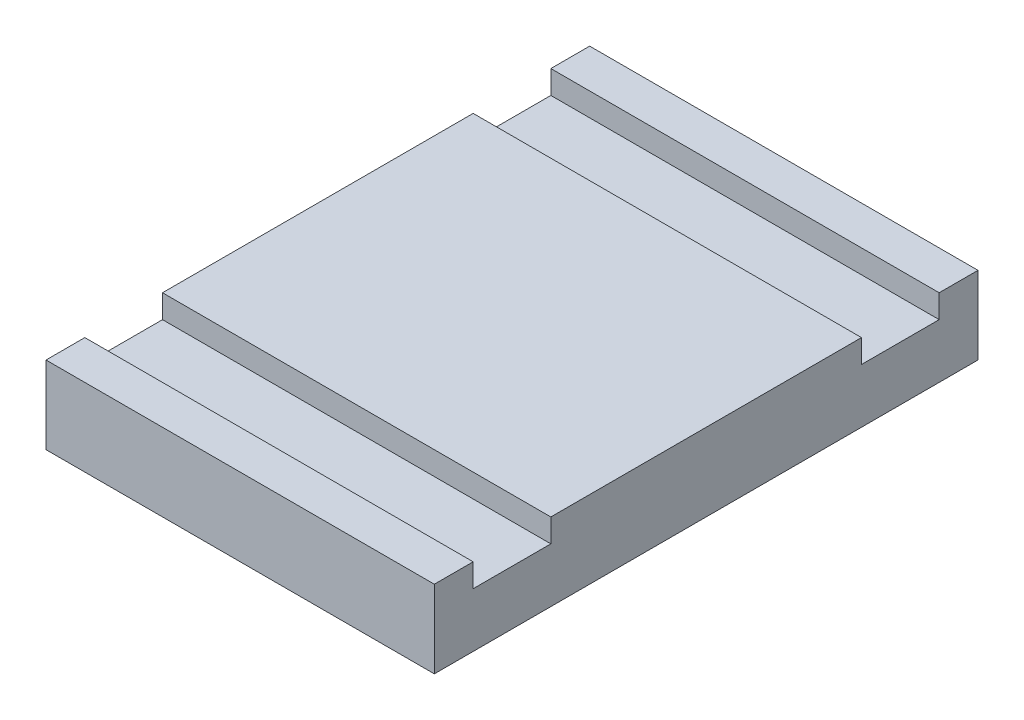
from build123d import *

# Parameters (mm, degrees)
SKETCH1_W           = 50
SKETCH1_H           = 70
BOSS_EXTRUDE1_DEPTH = 10
SKETCH3_W           = 10
SKETCH3_H           = 3
CUT_EXTRUDE1_DEPTH  = 62.846584384


with BuildPart() as part:
    # Sketch1 → Boss-Extrude1 (new body)
    with BuildSketch(Plane(origin=(0, 0, 0), x_dir=(1, 0, 0), z_dir=(0, 1, 0))):
        with Locations((25, 0)):
            Rectangle(SKETCH1_W, SKETCH1_H)
    extrude(amount=BOSS_EXTRUDE1_DEPTH)

    # Sketch3 → Cut-Extrude1 (cut, through all)
    with BuildSketch(Plane.ZY):
        with Locations((-25, 8.5)):
            Rectangle(SKETCH3_W, SKETCH3_H)
        with Locations((25, 8.5)):
            Rectangle(SKETCH3_W, SKETCH3_H)
    extrude(amount=-CUT_EXTRUDE1_DEPTH, mode=Mode.SUBTRACT)


solid = part.part
